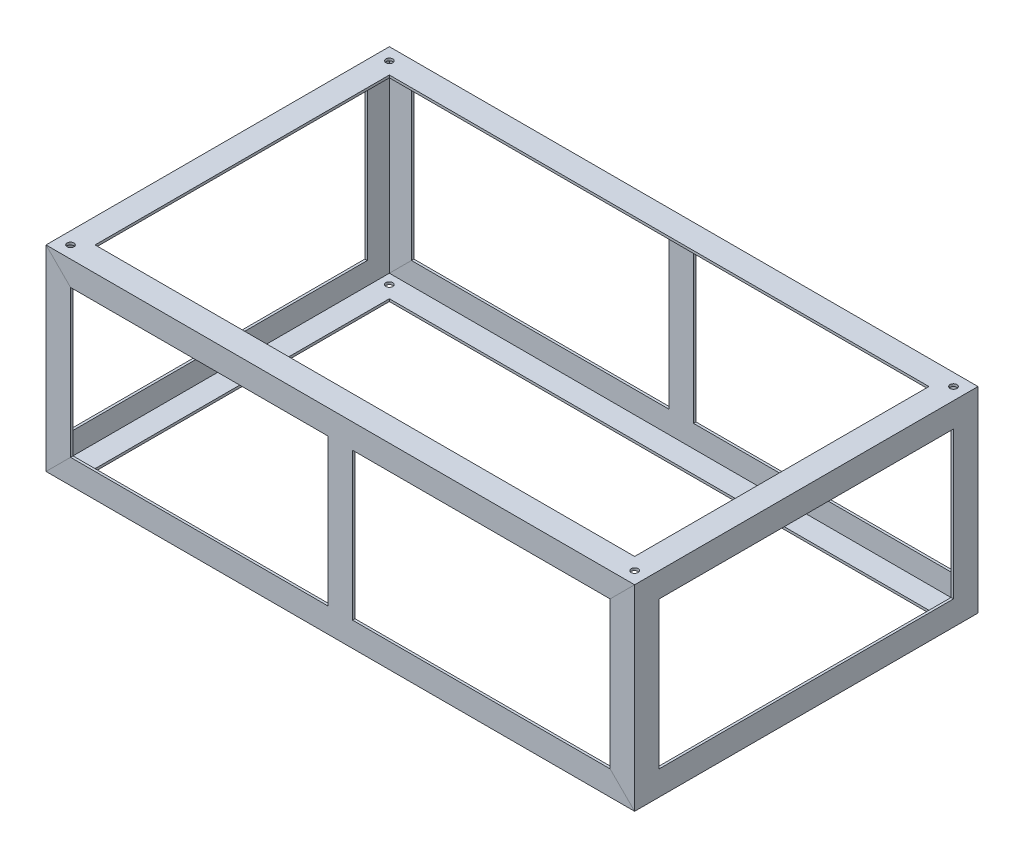
from build123d import *

# Parameters (mm, degrees)
SKETCH8_W           = 50
SKETCH8_H           = 300
BOSS_EXTRUDE2_DEPTH = 5
BOSS_EXTRUDE3_DEPTH = 600
SKETCH11_R          = 7
CUT_EXTRUDE1_DEPTH  = 405


with BuildPart() as part:
    # Sweep1: sweep along a path in Sketch3
    with BuildLine(Plane.XY) as sweep1_path:
        Line((0, 0), (1200, 0))
        Line((1200, 0), (1200, -400))
        Line((1200, -400), (0, -400))
        Line((0, -400), (0, 0))
    # Sketch1 → Sweep1 (sweep)
    with BuildSketch(Plane(origin=(0, 0, 0), x_dir=(0, 0, -1), z_dir=(1, 0, 0))):
        Polygon((0, 0), (0, -50), (5, -50), (5, -5), (50, -5), (50, 0), align=None)
    sweep(path=sweep1_path.line, transition=Transition.RIGHT)

    # Sketch8 → Boss-Extrude2 (add)
    with BuildSketch(Plane.XY):
        with Locations((600, -200)):
            Rectangle(SKETCH8_W, SKETCH8_H)
    extrude(amount=-BOSS_EXTRUDE2_DEPTH)


with BuildPart() as body_2:
    # Mirror8: mirrored copy
    add(part.part.mirror(Plane.XY.offset(-350)))


with BuildPart() as part_1:
    add(part.part)

    add(body_2.part)  # Boss-Extrude3 merges body 2
    # Sketch10 → Boss-Extrude3 (add)
    with BuildSketch(Plane.XY.offset(-650)):
        Polygon((50, 0), (0, 0), (0, -50), (5, -50), (5, -5), (50, -5), align=None)
        Polygon((1195, -50), (1200, -50), (1200, 0), (1150, 0), (1150, -5), (1195, -5), align=None)
        Polygon((1150, -400), (1200, -400), (1200, -350), (1195, -350), (1195, -395), (1150, -395), align=None)
        Polygon((5, -350), (0, -350), (0, -400), (50, -400), (50, -395), (5, -395), align=None)
    extrude(amount=BOSS_EXTRUDE3_DEPTH)

    # Sketch11 → Cut-Extrude1 (cut)
    with BuildSketch(Plane.XZ.offset(400)):
        with Locations(Location((25, -25, 0), (0, 0, 270))):
            Circle(SKETCH11_R)
        with Locations(Location((1175, -25, 0), (0, 0, 270))):
            Circle(SKETCH11_R)
        with Locations(Location((1175, -675, 0), (0, 0, 270))):
            Circle(SKETCH11_R)
        with Locations(Location((25, -675, 0), (0, 0, 270))):
            Circle(SKETCH11_R)
    extrude(amount=-CUT_EXTRUDE1_DEPTH, mode=Mode.SUBTRACT)


solid = part_1.part
